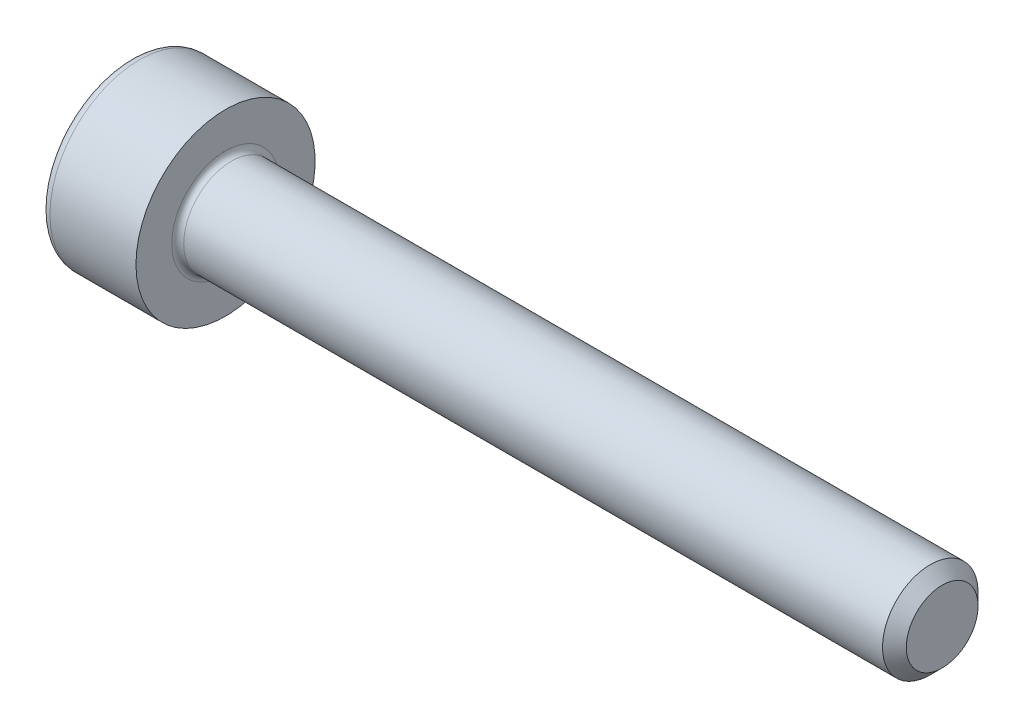
from build123d import *

# Parameters (mm, degrees)
FILLET1_R   = 0.1
FILLET2_R   = 0.16
HEX_2_DEPTH = 0.7


with BuildPart() as part:
    # BodySke → Base-Revolve (revolve)
    with BuildSketch(Plane.XY, mode=Mode.PRIVATE) as base_revolve_sk:
        Polygon((0, 0), (0, 1.5), (1.6, 1.5), (1.6, 0.8), (13.401, 0.8), (13.6, 0.601), (13.6, 0), align=None)
    revolve(base_revolve_sk.sketch.rotate(Axis((-31.75, 0, 0), (1, 0, 0)), 90), axis=Axis((-31.75, 0, 0), (1, 0, 0)))

    # Fillet1
    fillet1_edges = [part.edges().sort_by_distance(p)[0] for p in [
        (1.6, 0, -0.8),
    ]]
    fillet(fillet1_edges, radius=FILLET1_R)

    # Fillet2
    fillet2_edges = [part.edges().sort_by_distance(p)[0] for p in [
        (0, 0, -1.5),
    ]]
    fillet(fillet2_edges, radius=FILLET2_R)

    # Sketch2 → Hex-PreBroach (revolve, cut)
    with BuildSketch(Plane.XY, mode=Mode.PRIVATE) as hex_prebroach_sk:
        Polygon((0, 0.76), (0.7, 0.76), (1.138786205, 0), (0, 0), align=None)
    revolve(hex_prebroach_sk.sketch.rotate(Axis((0, 0, 0), (1, 0, 0)), 90), axis=Axis((0, 0, 0), (1, 0, 0)), mode=Mode.SUBTRACT)

    # Sketch3 → Hex 2 (cut)
    with BuildSketch(Plane(origin=(0, 0, 0), x_dir=(0, 0.500000000000001, 0.866025403784438), z_dir=(-1, 0, 0))):
        Polygon((0.438786205, 0.76), (-0.438786205, 0.76), (-0.877572409, 0), (-0.438786205, -0.76), (0.438786205, -0.76), (0.877572409, 0), align=None)
    extrude(amount=-HEX_2_DEPTH, mode=Mode.SUBTRACT)


solid = part.part
